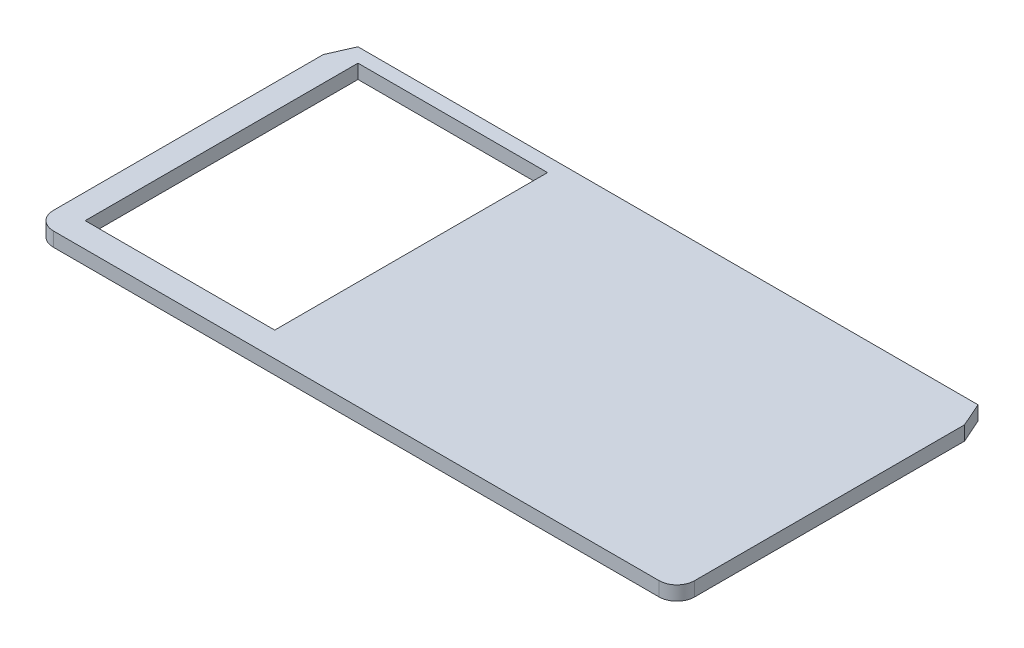
from build123d import *

# Parameters (mm, degrees)
SKETCH1_W           = 53.5
SKETCH1_H           = 77
BOSS_EXTRUDE1_DEPTH = 4
SKETCH2_W           = 40
SKETCH2_H           = 20
BOSS_EXTRUDE2_DEPTH = 2
SKETCH3_W           = 40
SKETCH3_H           = 20
BOSS_EXTRUDE3_DEPTH = 4


with BuildPart() as part:
    # Sketch1 → Boss-Extrude1 (new body)
    with BuildSketch(Plane(origin=(0, 0, 0), x_dir=(1, 0, 0), z_dir=(0, 1, 0))):
        with BuildLine():
            Line((-87.5, 42.5), (87.5, 42.5))
            Line((87.5, 42.5), (90.5, 35.7))
            Line((90.5, 35.7), (90.5, -40.5))
            ThreePointArc((90.5, -40.5), (89.035533906, -44.035533906), (85.5, -45.5))
            Line((85.5, -45.5), (-85.5, -45.5))
            ThreePointArc((-85.5, -45.5), (-89.035533906, -44.035533906), (-90.5, -40.5))
            Line((-90.5, -40.5), (-90.5, 35.7))
            Line((-90.5, 35.7), (-87.5, 42.5))
        make_face()
        with Locations((-56.75, 0)):
            Rectangle(SKETCH1_W, SKETCH1_H, mode=Mode.SUBTRACT)
    extrude(amount=BOSS_EXTRUDE1_DEPTH)

    # Sketch2 → Boss-Extrude2 (add)
    with BuildSketch(Plane(origin=(0, 0, 0), x_dir=(1, 0, 0), z_dir=(0, 1, 0))):
        Rectangle(SKETCH2_W, SKETCH2_H)
    extrude(amount=-BOSS_EXTRUDE2_DEPTH)

    # Sketch3 → Boss-Extrude3 (add)
    # profile 1 of 5: a face of its own
    with BuildSketch(Plane(origin=(0, -2, 0), x_dir=(1, 0, 0), z_dir=(0, 1, 0))):
        Rectangle(SKETCH3_W, SKETCH3_H)
        Polygon((-2, 9), (0, 9), (2, 9), (17.5, 9), (17.5, 2), (17.5, 0), (17.5, -2), (17.5, -9), (2, -9), (0, -9), (-2, -9), (-17.5, -9), (-17.5, -2), (-17.5, 0), (-17.5, 2), (-17.5, 9), align=None, mode=Mode.SUBTRACT)
    # profile 2 of 5: a face of its own
    with BuildSketch(Plane(origin=(0, -2, 0), x_dir=(1, 0, 0), z_dir=(0, 1, 0))):
        Polygon((-17.5, 2), (-2, 9), (-17.5, 9), align=None)
    # profile 3 of 5: a face of its own
    with BuildSketch(Plane(origin=(0, -2, 0), x_dir=(1, 0, 0), z_dir=(0, 1, 0))):
        Polygon((-2, -9), (-17.5, -2), (-17.5, -9), align=None)
    # profile 4 of 5: a face of its own
    with BuildSketch(Plane(origin=(0, -2, 0), x_dir=(1, 0, 0), z_dir=(0, 1, 0))):
        Polygon((17.5, -9), (17.5, -2), (2, -9), align=None)
    # profile 5 of 5: a face of its own
    with BuildSketch(Plane(origin=(0, -2, 0), x_dir=(1, 0, 0), z_dir=(0, 1, 0))):
        Polygon((17.5, 9), (2, 9), (17.5, 2), align=None)
    extrude(amount=-BOSS_EXTRUDE3_DEPTH)


solid = part.part
